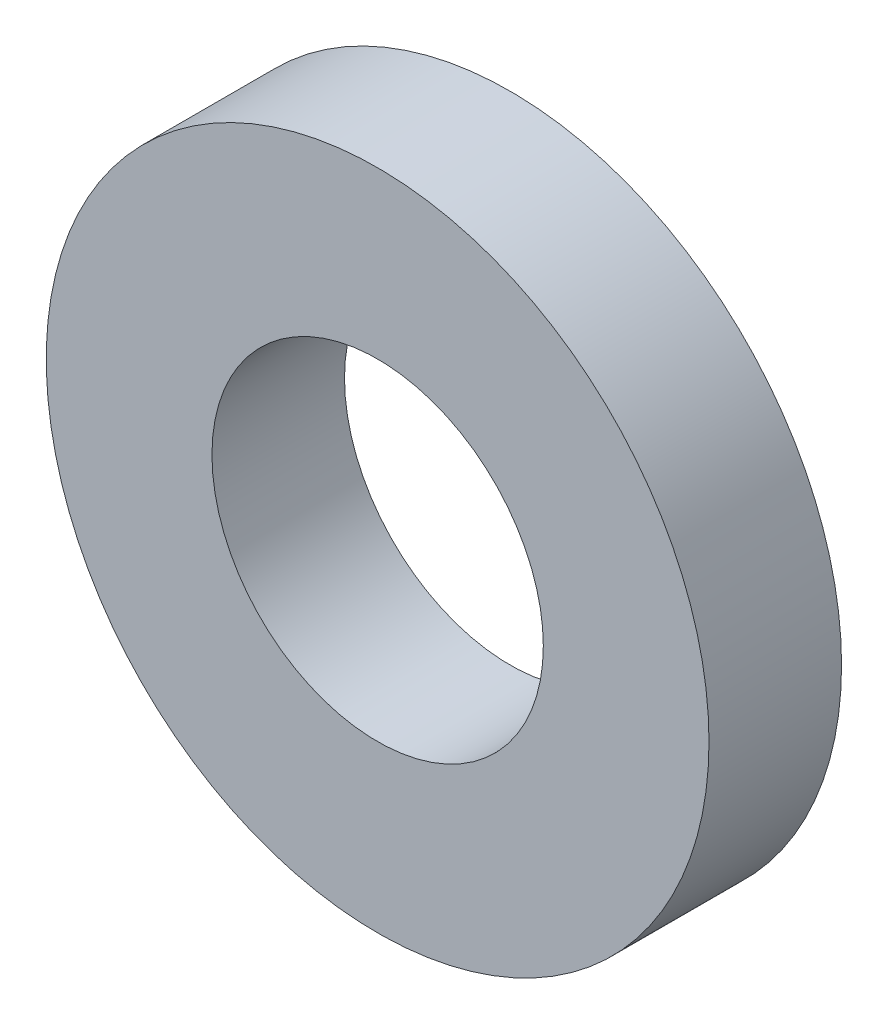
from build123d import *

# Parameters (mm, degrees)
SKETCH1_R           = 3
SKETCH1_R_2         = 1.5
BOSS_EXTRUDE1_DEPTH = 0.6


with BuildPart() as part:
    # Sketch1 → Boss-Extrude1 (new, symmetric)
    with BuildSketch(Plane.XY):
        Circle(SKETCH1_R)
        Circle(SKETCH1_R_2, mode=Mode.SUBTRACT)
    extrude(amount=BOSS_EXTRUDE1_DEPTH, both=True)


solid = part.part
